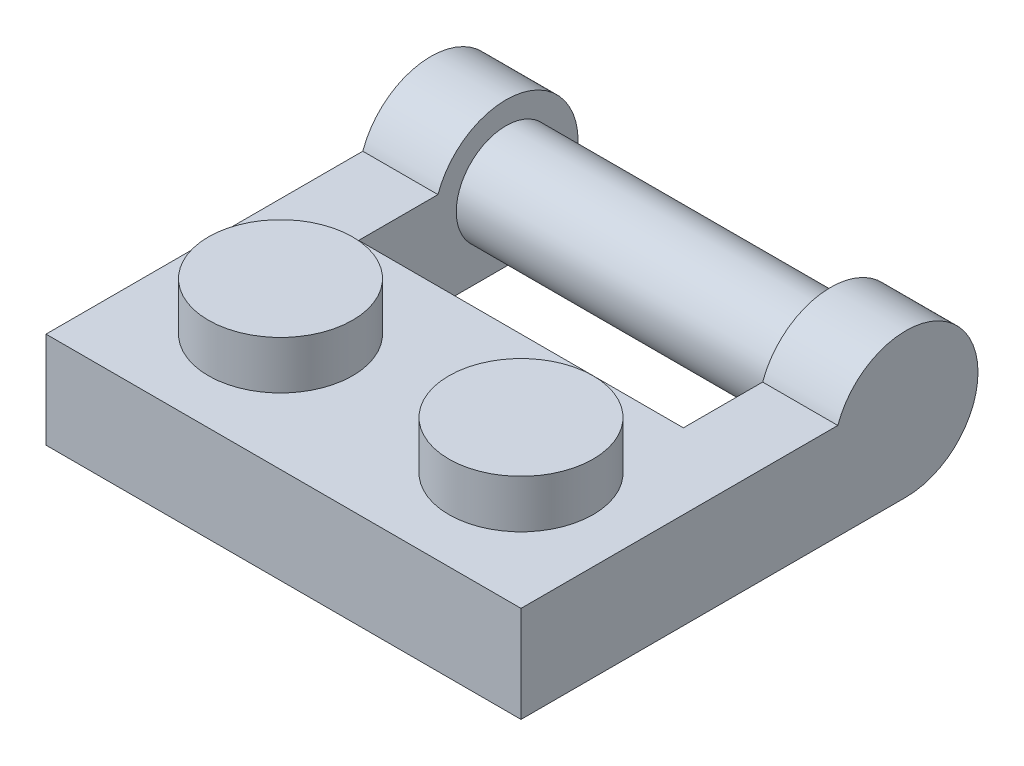
from build123d import *

# Parameters (mm, degrees)
MAINBASESKETCH_W        = 15.8
MAINBASESKETCH_H        = 3.2
MAINBASEEXTRUDE_DEPTH   = 7.9
STUDSSKETCH_R           = 2.4
STUDSEXTRUDE_DEPTH      = 1.6
STUDSPATTERN_COUNT      = 2
STUDSPATTERN_PITCH      = 8
STUDSPATTERN_COUNT_DIR2 = 2
STUDSPATTERN_PITCH_DIR2 = 8
MAINBASESHELL_T         = -1.2
LCUTBLUE_DEPTH          = 19.555463972
LCUTBLUE_DEPTH_BACK     = 19.555463972
MADESLIMCUTSKETCH_W     = 7.9
MADESLIMCUTSKETCH_H     = 7.9
MADESLIMCUT_DEPTH       = 19.897228453
SLIMHOLEEXT_START       = -0.2
SLIMHOLESKETCH_R        = 1.75
SLIMHOLESKETCH_R_2      = 0.75
SLIMHOLEEXT_DEPTH       = 2
BOSS_EXTRUDE2_DEPTH     = 2.5
SKETCH80_R              = 1.653025405
BOSS_EXTRUDE3_DEPTH     = 14


with BuildPart() as part:
    # MainBaseSketch → MainBaseExtrude (new, symmetric)
    with BuildSketch(Plane.XY):
        with Locations((8.581967213, 1.6)):
            Rectangle(MAINBASESKETCH_W, MAINBASESKETCH_H)
    extrude(amount=MAINBASEEXTRUDE_DEPTH, both=True)

    # StudsSketch → StudsExtrude (add)
    with BuildSketch(Plane(origin=(0, 3.2, 0), x_dir=(1, 0, 0), z_dir=(0, 1, 0))):
        with Locations((4.581967213, 4)):
            Circle(STUDSSKETCH_R)
    studsextrude = extrude(amount=STUDSEXTRUDE_DEPTH)

    # StudsPattern: StudsExtrude 2 × 2
    with Locations(*[(j * STUDSPATTERN_PITCH_DIR2, 0, i * STUDSPATTERN_PITCH) for i in range(STUDSPATTERN_COUNT) for j in range(STUDSPATTERN_COUNT_DIR2) if (i, j) != (0, 0)]):
        add(studsextrude)

    # MainBaseShell
    mainbaseshell_openings = [part.faces().sort_by_distance(p)[0] for p in [
        (8.581967213, 0, 0),
    ]]
    offset(amount=MAINBASESHELL_T, openings=mainbaseshell_openings, kind=Kind.INTERSECTION)

    # LCUTBlueSketch → LCutBlue (cut, two sides: drawn at the far end of the back side and taken through both)
    with BuildSketch(Plane(origin=(0, 3.2, 0), x_dir=(1, 0, 0), z_dir=(0, 1, 0)).offset(-LCUTBLUE_DEPTH_BACK)):
        Polygon((8.581967213, 53.229874044), (8.581967213, 7.9), (8.581967213, 0), (16.481967213, 0), (61.811841258, 0), (125.917963912, 64.106122654), (72.688089868, 117.335996699), align=None)
    extrude(amount=LCUTBLUE_DEPTH + LCUTBLUE_DEPTH_BACK, mode=Mode.SUBTRACT)

    # MadeSlimCutSketch → MadeSlimCut (cut, through all)
    with BuildSketch(Plane.XZ):
        with Locations((4.631967213, -3.95)):
            Rectangle(MADESLIMCUTSKETCH_W, MADESLIMCUTSKETCH_H)
    extrude(amount=-MADESLIMCUT_DEPTH, mode=Mode.SUBTRACT)

    # SlimHoleSketch → SlimHoleExt (add)
    with BuildSketch(Plane.XZ.offset(-2).offset(SLIMHOLEEXT_START)):
        with Locations((8.581967213, 4)):
            Circle(SLIMHOLESKETCH_R)
        with Locations((8.581967213, 4)):
            Circle(SLIMHOLESKETCH_R_2, mode=Mode.SUBTRACT)
    extrude(amount=SLIMHOLEEXT_DEPTH)

    # Sketch78 → Boss-Extrude2 (add)
    with BuildSketch(Plane.ZY.offset(-0.681967213)):
        with BuildLine():
            Line((0, 0), (-4.9, 0))
            ThreePointArc((-4.9, 0), (-6.859591794, 3.785640646), (-2.6372583, 3.2))
            Line((-2.6372583, 3.2), (0, 3.2))
            Line((0, 3.2), (0, 0))
        make_face()
    boss_extrude2 = extrude(amount=-BOSS_EXTRUDE2_DEPTH)

    # Mirror9: Boss-Extrude2 across plane
    add(boss_extrude2.mirror(Plane.ZY.offset(-8.581967213)))

    # Sketch80 → Boss-Extrude3 (add)
    with BuildSketch(Plane.ZY.offset(-0.681967213)):
        with Locations((-4.9, 2.4)):
            Circle(SKETCH80_R)
    extrude(amount=-BOSS_EXTRUDE3_DEPTH)


solid = part.part
